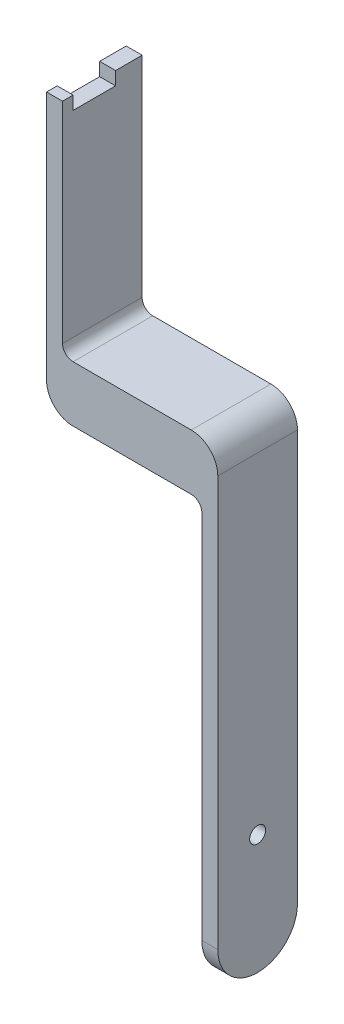
from build123d import *

# Parameters (mm, degrees)
BOSS_EXTRUDE1_DEPTH      = 32.251106428
SKETCH2_W                = 29.251106428
SKETCH2_H                = 41.502212856
CUT_EXTRUDE1_DEPTH       = 114.890196446
SKETCH3_W                = 29.251106428
SKETCH3_H                = 79.251106428
CUT_EXTRUDE2_DEPTH       = 114.890196446
SKETCH4_W                = 8
SKETCH4_H                = 2.5
CUT_EXTRUDE3_DEPTH       = 141.365930027
F_3_0_3_DIAMETER_HOLE1_D = 3
FILLET1_R                = 2
FILLET2_R                = 5


with BuildPart() as part:
    # Sketch1 → Boss-Extrude1 (new body)
    with BuildSketch(Plane(origin=(72.251106428, 0, 0), x_dir=(0, 0, -1), z_dir=(1, 0, 0))):
        with BuildLine():
            Line((105.530592626, -79.251106428), (105.530592626, 44.502212856))
            Line((105.530592626, 44.502212856), (90.530592626, 44.502212856))
            Line((90.530592626, 44.502212856), (90.530592626, -79.251106428))
            ThreePointArc((90.530592626, -79.251106428), (98.030592626, -86.751106428), (105.530592626, -79.251106428))
        make_face()
    extrude(amount=-BOSS_EXTRUDE1_DEPTH)

    # Sketch2 → Cut-Extrude1 (cut, through all)
    with BuildSketch(Plane(origin=(0, 0, -105.530592626), x_dir=(-1, 0, 0), z_dir=(0, 0, -1))):
        with Locations((-57.625553214, 23.751106428)):
            Rectangle(SKETCH2_W, SKETCH2_H)
    extrude(amount=-CUT_EXTRUDE1_DEPTH, mode=Mode.SUBTRACT)

    # Sketch3 → Cut-Extrude2 (cut, through all)
    with BuildSketch(Plane(origin=(0, 0, -105.530592626), x_dir=(-1, 0, 0), z_dir=(0, 0, -1))):
        with Locations((-54.625553214, -47.125553214)):
            Rectangle(SKETCH3_W, SKETCH3_H)
    extrude(amount=-CUT_EXTRUDE2_DEPTH, mode=Mode.SUBTRACT)

    # Sketch4 → Cut-Extrude3 (cut, through all)
    with BuildSketch(Plane.ZY.offset(-40)):
        with Locations((-96.530592626, 43.252212856)):
            Rectangle(SKETCH4_W, SKETCH4_H)
    extrude(amount=-CUT_EXTRUDE3_DEPTH, mode=Mode.SUBTRACT)

    # Ø3.0 (3) Diameter Hole1 (through all)
    with Locations(Plane.ZY.offset(-69.251106428)):
        with Locations((-98.030592626, -64.251106428)):
            Hole(F_3_0_3_DIAMETER_HOLE1_D / 2)

    # Fillet1
    fillet1_edges = [part.edges().sort_by_distance(p)[0] for p in [
        (43, 3, -98.030592626),
        (69.251106428, -7.5, -98.030592626),
    ]]
    fillet(fillet1_edges, radius=FILLET1_R)

    # Fillet2
    fillet2_edges = [part.edges().sort_by_distance(p)[0] for p in [
        (72.251106428, 3, -98.030592626),
        (40, -7.5, -98.030592626),
    ]]
    fillet(fillet2_edges, radius=FILLET2_R)


solid = part.part
